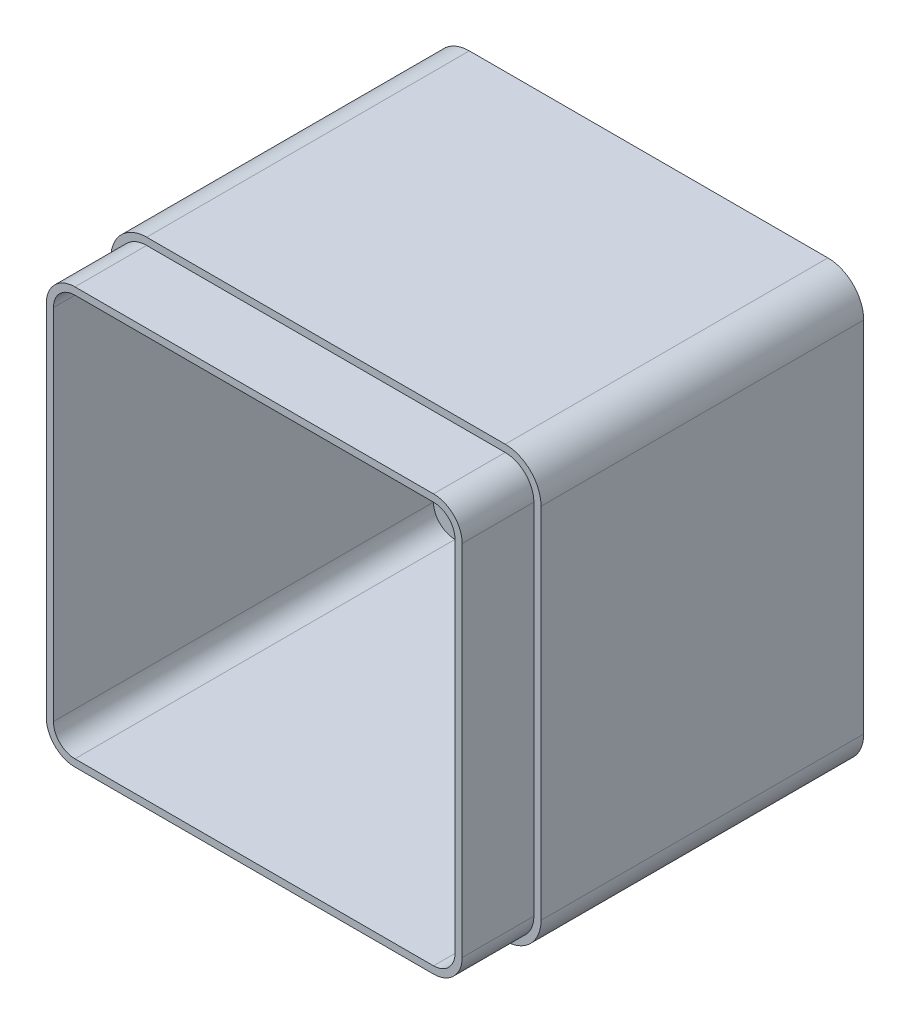
from build123d import *

# Parameters (mm, degrees)
SKETCH1_W           = 120
SKETCH1_H           = 120
BOSS_EXTRUDE1_DEPTH = 90
FILLET1_R           = 10
SHELL1_T            = -4
BOSS_EXTRUDE3_START = 20
BOSS_EXTRUDE3_DEPTH = 20


with BuildPart() as part:
    # Sketch1 → Boss-Extrude1 (new body)
    with BuildSketch(Plane.XY):
        with Locations((60, 60)):
            Rectangle(SKETCH1_W, SKETCH1_H)
    extrude(amount=BOSS_EXTRUDE1_DEPTH)

    # Fillet1
    fillet1_edges = [part.edges().sort_by_distance(p)[0] for p in [
        (0, 0, 45),
        (120, 0, 45),
        (0, 120, 45),
        (120, 120, 45),
    ]]
    fillet(fillet1_edges, radius=FILLET1_R)

    # Shell1
    shell1_openings = [part.faces().sort_by_distance(p)[0] for p in [
        (60, 60, 90),
    ]]
    offset(amount=SHELL1_T, openings=shell1_openings, kind=Kind.INTERSECTION)

    # Sketch2 → Boss-Extrude3 (add)
    with BuildSketch(Plane.XY.offset(90).offset(BOSS_EXTRUDE3_START)):
        with BuildLine():
            ThreePointArc((10, 118), (4.343145751, 115.656854249), (2, 110))
            Line((2, 110), (2, 10))
            ThreePointArc((2, 10), (4.343145751, 4.343145751), (10, 2))
            Line((10, 2), (110, 2))
            ThreePointArc((110, 2), (115.656854249, 4.343145751), (118, 10))
            Line((118, 10), (118, 110))
            ThreePointArc((118, 110), (115.656854249, 115.656854249), (110, 118))
            Line((110, 118), (10, 118))
        make_face()
        with BuildLine():
            Line((110, 4), (10, 4))
            ThreePointArc((10, 4), (5.757359313, 5.757359313), (4, 10))
            Line((4, 10), (4, 110))
            ThreePointArc((4, 110), (5.757359313, 114.242640687), (10, 116))
            Line((10, 116), (110, 116))
            ThreePointArc((110, 116), (114.242640687, 114.242640687), (116, 110))
            Line((116, 110), (116, 10))
            ThreePointArc((116, 10), (114.242640687, 5.757359313), (110, 4))
        make_face(mode=Mode.SUBTRACT)
    extrude(amount=-BOSS_EXTRUDE3_DEPTH)


solid = part.part
